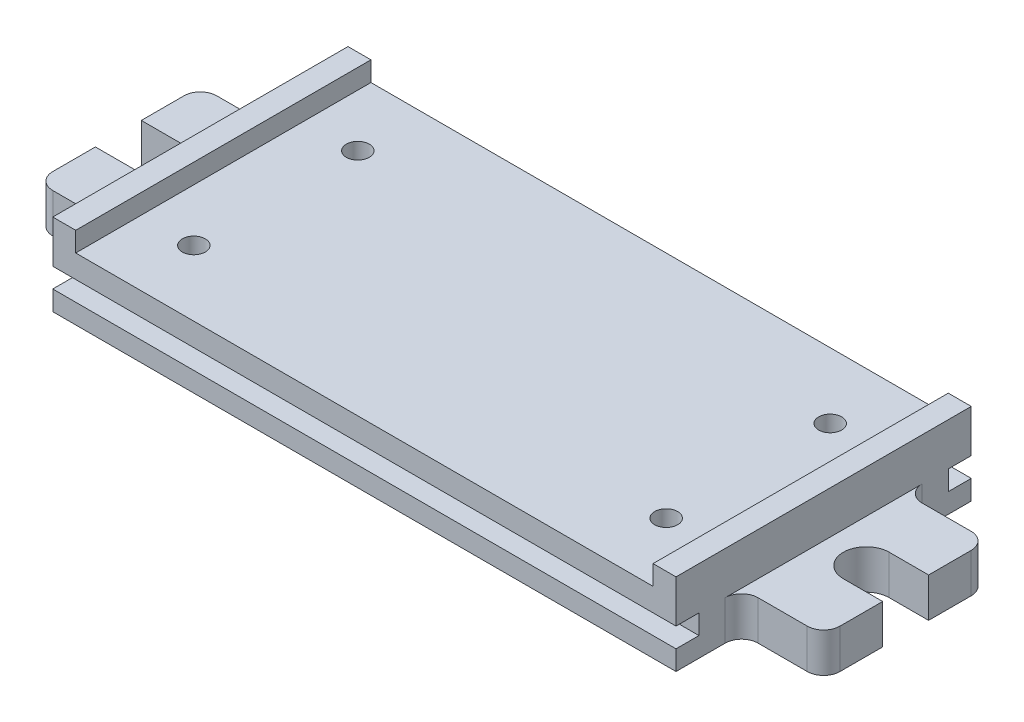
from build123d import *

# Parameters (mm, degrees)
BOSS_EXTRUDE1_DEPTH   = 25
BOSS_EXTRUDE1_2_DEPTH = 25
SKETCH1_3_W           = 176
SKETCH1_3_H           = 90
BOSS_EXTRUDE2_DEPTH   = 19
BOSS_EXTRUDE3_DEPTH   = 12
CUT_EXTRUDE1_DEPTH    = 6
CUT_EXTRUDE2_REACH    = 223.077
SKETCH2_W             = 7
SKETCH2_H             = 6
M8X1_0_TAPPED_HOLE1_D = 7
LPATTERN1_COUNT       = 2
LPATTERN1_PITCH       = 50
LPATTERN1_COUNT_DIR2  = 2
LPATTERN1_PITCH_DIR2  = 144
FILLET1_R             = 5


with BuildPart() as part:
    # Sketch1 → Boss-Extrude1 (new body)
    with BuildSketch(Plane(origin=(0, 0, 0), x_dir=(1, 0, 0), z_dir=(0, 1, 0))):
        Polygon((95, 45), (88, 45), (88, -45), (95, -45), (95, -25), (95, 25), align=None)
    extrude(amount=BOSS_EXTRUDE1_DEPTH)



with BuildPart() as body_2:
    # Sketch1 → Boss-Extrude1 2 (new body)
    with BuildSketch(Plane(origin=(0, 0, 0), x_dir=(1, 0, 0), z_dir=(0, 1, 0))):
        Polygon((-88, -45), (-88, 45), (-95, 45), (-95, 25), (-95, -25), (-95, -45), align=None)
    extrude(amount=BOSS_EXTRUDE1_2_DEPTH)


with BuildPart() as part_1:
    add(part.part)

    add(body_2.part)  # Boss-Extrude2 merges body 2
    # Sketch1<3> → Boss-Extrude2 (add)
    # profile 1 of 2: a face of its own
    with BuildSketch(Plane(origin=(0, 0, 0), x_dir=(1, 0, 0), z_dir=(0, 1, 0))):
        Rectangle(SKETCH1_3_W, SKETCH1_3_H)
        with BuildLine():
            ThreePointArc((-82, 25), (-80.535533906, 28.535533906), (-77, 30))
            Line((-77, 30), (77, 30))
            ThreePointArc((77, 30), (80.535533906, 28.535533906), (82, 25))
            Line((82, 25), (82, -25))
            ThreePointArc((82, -25), (80.535533906, -28.535533906), (77, -30))
            Line((77, -30), (-77, -30))
            ThreePointArc((-77, -30), (-80.535533906, -28.535533906), (-82, -25))
            Line((-82, -25), (-82, 25))
        make_face(mode=Mode.SUBTRACT)
    # profile 2 of 2: a face of its own
    with BuildSketch(Plane(origin=(0, 0, 0), x_dir=(1, 0, 0), z_dir=(0, 1, 0))):
        with BuildLine():
            Line((-77, 30), (77, 30))
            ThreePointArc((77, 30), (80.535533906, 28.535533906), (82, 25))
            Line((82, 25), (82, -25))
            ThreePointArc((82, -25), (80.535533906, -28.535533906), (77, -30))
            Line((77, -30), (-77, -30))
            ThreePointArc((-77, -30), (-80.535533906, -28.535533906), (-82, -25))
            Line((-82, -25), (-82, 25))
            ThreePointArc((-82, 25), (-80.535533906, 28.535533906), (-77, 30))
        make_face()
    extrude(amount=BOSS_EXTRUDE2_DEPTH)

    # Sketch1<4> → Boss-Extrude3 (add)
    with BuildSketch(Plane(origin=(0, 0, 0), x_dir=(1, 0, 0), z_dir=(0, 1, 0))):
        with BuildLine():
            Line((120, 25), (95, 25))
            Line((95, 25), (95, -25))
            Line((95, -25), (120, -25))
            Line((120, -25), (120, -7))
            Line((120, -7), (108, -7))
            ThreePointArc((108, -7), (101, 0), (108, 7))
            Line((108, 7), (120, 7))
            Line((120, 7), (120, 25))
        make_face()
        with BuildLine():
            Line((-95, -25), (-95, 25))
            Line((-95, 25), (-120, 25))
            Line((-120, 25), (-120, 7))
            Line((-120, 7), (-108, 7))
            ThreePointArc((-108, 7), (-101, 0), (-108, -7))
            Line((-108, -7), (-120, -7))
            Line((-120, -7), (-120, -25))
            Line((-120, -25), (-95, -25))
        make_face()
    extrude(amount=BOSS_EXTRUDE3_DEPTH)

    # Sketch1<5> → Cut-Extrude1 (cut)
    with BuildSketch(Plane(origin=(0, 0, 0), x_dir=(1, 0, 0), z_dir=(0, 1, 0))):
        with BuildLine():
            Line((-77, 30), (77, 30))
            ThreePointArc((77, 30), (80.535533906, 28.535533906), (82, 25))
            Line((82, 25), (82, -25))
            ThreePointArc((82, -25), (80.535533906, -28.535533906), (77, -30))
            Line((77, -30), (-77, -30))
            ThreePointArc((-77, -30), (-80.535533906, -28.535533906), (-82, -25))
            Line((-82, -25), (-82, 25))
            ThreePointArc((-82, 25), (-80.535533906, 28.535533906), (-77, 30))
        make_face()
    extrude(amount=CUT_EXTRUDE1_DEPTH, mode=Mode.SUBTRACT)

    # Sketch2 → Cut-Extrude2 (cut, up to next)
    with BuildSketch(Plane(origin=(95, 0, 0), x_dir=(0, 0, -1), z_dir=(1, 0, 0)), mode=Mode.PRIVATE) as cut_extrude2_sk1:
        with Locations((41.5, 9)):
            Rectangle(SKETCH2_W, SKETCH2_H)
    cut_extrude2_tool1 = extrude(cut_extrude2_sk1.sketch, amount=-CUT_EXTRUDE2_REACH, mode=Mode.PRIVATE) & part_1.part
    # Sketch2 → Cut-Extrude2 (cut, up to next)
    with BuildSketch(Plane(origin=(95, 0, 0), x_dir=(0, 0, -1), z_dir=(1, 0, 0)), mode=Mode.PRIVATE) as cut_extrude2_sk2:
        with Locations((-41.5, 9)):
            Rectangle(SKETCH2_W, SKETCH2_H)
    cut_extrude2_tool2 = extrude(cut_extrude2_sk2.sketch, amount=-CUT_EXTRUDE2_REACH, mode=Mode.PRIVATE) & part_1.part
    add(cut_extrude2_tool1.solids().sort_by_distance((95, 9, -41.5))[0], mode=Mode.SUBTRACT)
    add(cut_extrude2_tool2.solids().sort_by_distance((95, 9, 41.5))[0], mode=Mode.SUBTRACT)

    # M8x1.0 Tapped Hole1 (through all)
    with Locations(Plane(origin=(0, 19, 0), x_dir=(1, 0, 0), z_dir=(0, 1, 0))):
        with Locations((72, -25)):
            m8x1_0_tapped_hole1 = Hole(M8X1_0_TAPPED_HOLE1_D / 2)

    # LPattern1: M8x1.0 Tapped Hole1 2 × 2
    with Locations(*[(-j * LPATTERN1_PITCH_DIR2, 0, -i * LPATTERN1_PITCH) for i in range(LPATTERN1_COUNT) for j in range(LPATTERN1_COUNT_DIR2) if (i, j) != (0, 0)]):
        add(m8x1_0_tapped_hole1, mode=Mode.SUBTRACT)

    # Fillet1
    fillet1_edges = [part_1.edges().sort_by_distance(p)[0] for p in [
        (120, 6, -25),
        (95, 6, -25),
        (95, 6, 25),
        (120, 6, 25),
        (-120, 6, 25),
        (-95, 6, 25),
        (-95, 6, -25),
        (-120, 6, -25),
    ]]
    fillet(fillet1_edges, radius=FILLET1_R)


solid = part_1.part
